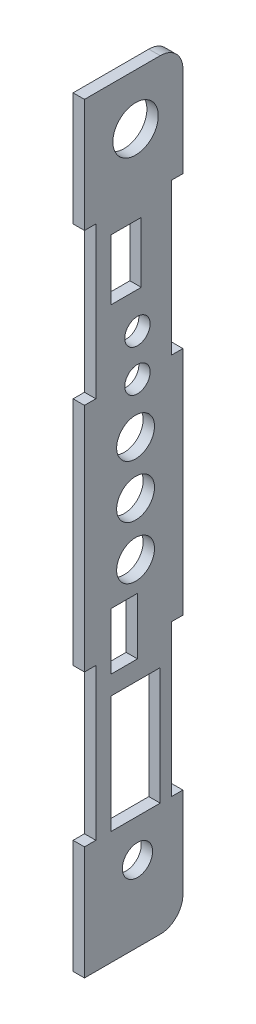
from build123d import *

# Parameters (mm, degrees)
SKETCH_1_W          = 26
SKETCH_1_H          = 201
EXTRUDE_1_DEPTH     = 3
SKETCH_5_W          = 3
SKETCH_5_H          = 40
CUT_EXTRUDE_1_DEPTH = 3
FILLET_1_R          = 6
FILLET_2_R          = 6
SKETCH_6_R          = 4
SKETCH_6_R_2        = 5
SKETCH_6_R_3        = 3.355744506
SKETCH_6_R_4        = 6
SKETCH_6_W          = 13
SKETCH_6_H          = 31
SKETCH_6_W_2        = 7
SKETCH_6_H_2        = 15
SKETCH_6_W_3        = 8
SKETCH_6_H_3        = 16
CUT_EXTRUDE_2_DEPTH = 3


with BuildPart() as part:
    # 草图1 → 凸台-拉伸1 (new body)
    with BuildSketch(Plane(origin=(0, 0, 0), x_dir=(0, 0, -1), z_dir=(1, 0, 0))):
        with Locations((-160.472227767, -5.969447374)):
            Rectangle(SKETCH_1_W, SKETCH_1_H)
    extrude(amount=EXTRUDE_1_DEPTH)

    # 草图5 → 切除-拉伸1 (cut)
    with BuildSketch(Plane(origin=(3, 0, 0), x_dir=(0, 0, -1), z_dir=(1, 0, 0))):
        with Locations((-148.972227767, 44.530552626)):
            Rectangle(SKETCH_5_W, SKETCH_5_H)
        with Locations((-171.972227767, 44.530552626)):
            Rectangle(SKETCH_5_W, SKETCH_5_H)
        with Locations((-171.972227767, -56.469447374)):
            Rectangle(SKETCH_5_W, SKETCH_5_H)
        with Locations((-148.972227767, -56.469447374)):
            Rectangle(SKETCH_5_W, SKETCH_5_H)
    extrude(amount=-CUT_EXTRUDE_1_DEPTH, mode=Mode.SUBTRACT)

    # 圆角1
    fillet_1_edges = [part.edges().sort_by_distance(p)[0] for p in [
        (1.5, 94.530552626, 147.472227767),
    ]]
    fillet(fillet_1_edges, radius=FILLET_1_R)

    # 圆角2
    fillet_2_edges = [part.edges().sort_by_distance(p)[0] for p in [
        (1.5, -106.469447374, 147.472227767),
    ]]
    fillet(fillet_2_edges, radius=FILLET_2_R)

    # 草图6 → 切除-拉伸2 (cut)
    with BuildSketch(Plane.ZY):
        with Locations((159.472227767, -86.469447374)):
            Circle(SKETCH_6_R)
        with Locations((159.972227767, -17.469447374)):
            Circle(SKETCH_6_R_2)
        with Locations((159.972227767, -3.469447374)):
            Circle(SKETCH_6_R_2)
        with Locations((159.972227767, 10.530552626)):
            Circle(SKETCH_6_R_2)
        with Locations((159.472227767, 23.530552626)):
            Circle(SKETCH_6_R_3)
        with Locations((159.472227767, 34.530552626)):
            Circle(SKETCH_6_R_3)
        with Locations((159.972227767, 81.030552626)):
            Circle(SKETCH_6_R_4)
        with Locations((159.972227767, -60.969447374)):
            Rectangle(SKETCH_6_W, SKETCH_6_H)
        with Locations((162.972227767, -32.969447374)):
            Rectangle(SKETCH_6_W_2, SKETCH_6_H_2)
        with Locations((162.472227767, 52.030552626)):
            Rectangle(SKETCH_6_W_3, SKETCH_6_H_3)
    extrude(amount=-CUT_EXTRUDE_2_DEPTH, mode=Mode.SUBTRACT)


solid = part.part
